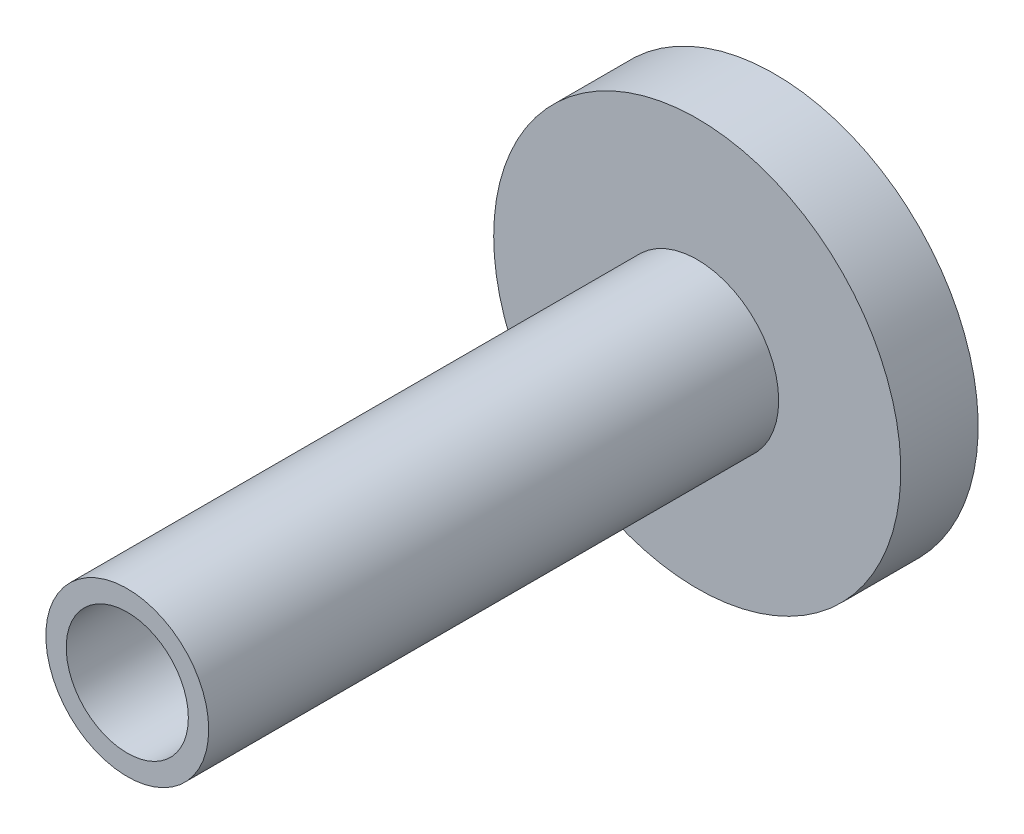
from build123d import *

# Parameters (mm, degrees)
SKETCH_1_R          = 5
EXTRUDE_1_DEPTH     = 1.9
SKETCH_2_R          = 2
EXTRUDE_2_DEPTH     = 14
SKETCH_3_R          = 1.5
CUT_EXTRUDE_1_DEPTH = 12


with BuildPart() as part:
    # 草图1 → 凸台-拉伸1 (new body)
    with BuildSketch(Plane.XY):
        with Locations(Location((0, 0, 0), (0, 0, 180))):
            Circle(SKETCH_1_R)
    extrude(amount=EXTRUDE_1_DEPTH)

    # 草图2 → 凸台-拉伸2 (add)
    with BuildSketch(Plane.XY.offset(1.9)):
        Circle(SKETCH_2_R)
    extrude(amount=EXTRUDE_2_DEPTH)

    # 草图3 → 切除-拉伸1 (cut)
    with BuildSketch(Plane.XY.offset(15.9)):
        Circle(SKETCH_3_R)
    extrude(amount=-CUT_EXTRUDE_1_DEPTH, mode=Mode.SUBTRACT)


solid = part.part
